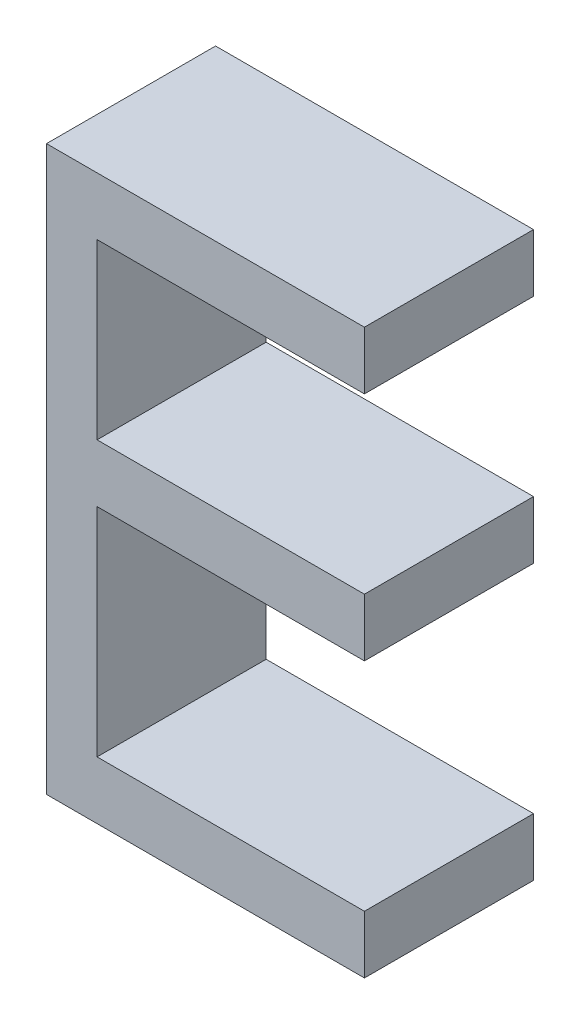
from build123d import *

# Parameters (mm, degrees)
BOSS_EXTRU_1_DEPTH = 1.5


with BuildPart() as part:
    # Esquisse1 → Boss.-Extru.1 (new body)
    with BuildSketch(Plane.XY):
        Polygon((-55.432465326, -17.870119076), (-52.611952505, -17.870119076), (-52.611952505, -18.382939589), (-54.983747377, -18.382939589), (-54.983747377, -19.921401128), (-52.611952505, -19.921401128), (-52.611952505, -20.43422164), (-54.983747377, -20.43422164), (-54.983747377, -22.357298563), (-52.611952505, -22.357298563), (-52.611952505, -22.870119076), (-55.432465326, -22.870119076), align=None)
    extrude(amount=BOSS_EXTRU_1_DEPTH)


solid = part.part
